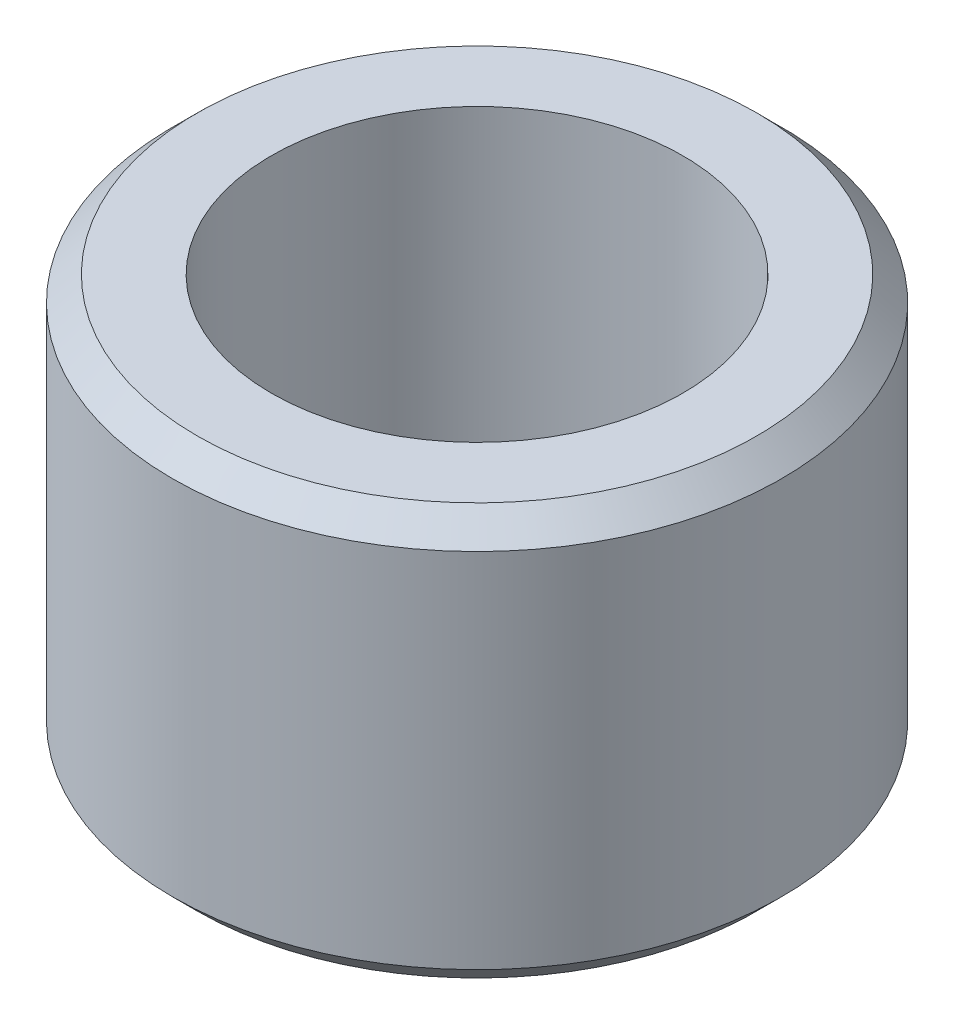
from build123d import *

# Parameters (mm, degrees)
SKETCH1_R           = 3.7
SKETCH1_R_2         = 2.5
BOSS_EXTRUDE1_DEPTH = 5
CHAMFER1_SIZE       = 0.3


with BuildPart() as part:
    # Sketch1 → Boss-Extrude1 (new body)
    with BuildSketch(Plane(origin=(0, 0, 0), x_dir=(1, 0, 0), z_dir=(0, 1, 0))):
        with Locations(Location((0, 0, 0), (0, 0, 270))):
            Circle(SKETCH1_R)
        with Locations(Location((0, 0, 0), (0, 0, 270))):
            Circle(SKETCH1_R_2, mode=Mode.SUBTRACT)
    extrude(amount=BOSS_EXTRUDE1_DEPTH)

    # Chamfer1
    chamfer1_edges = [part.edges().sort_by_distance(p)[0] for p in [
        (0, 0, -3.7),
        (0, 5, -3.7),
    ]]
    chamfer(chamfer1_edges, length=CHAMFER1_SIZE)


solid = part.part
